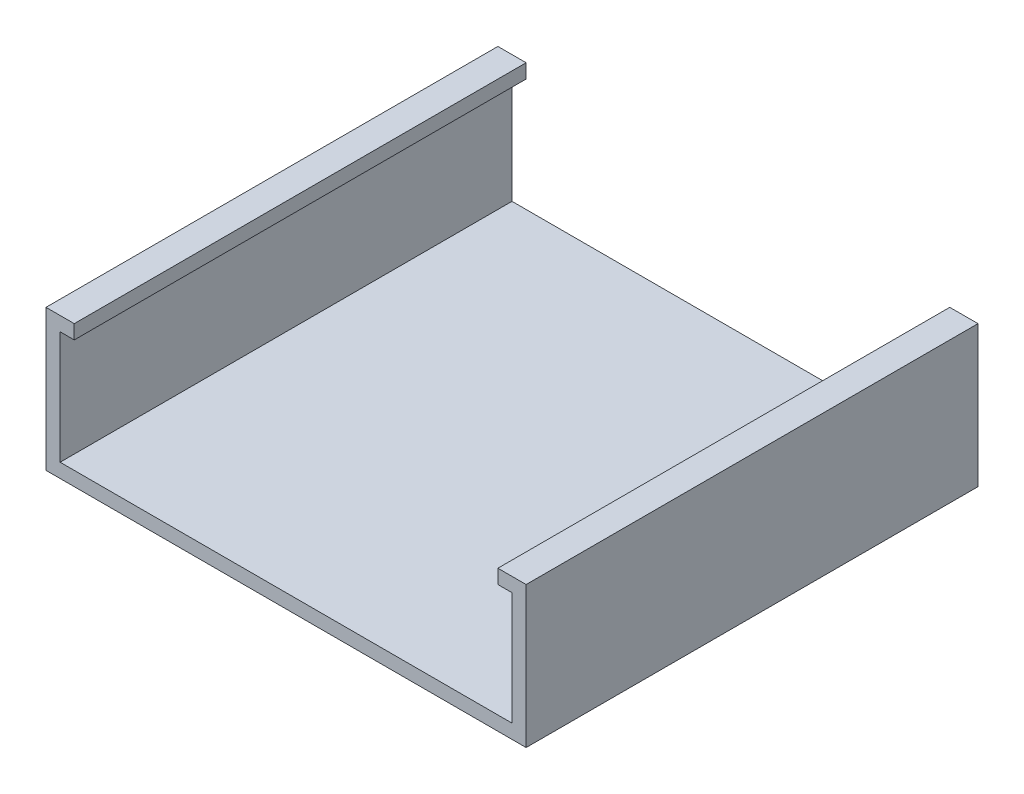
from build123d import *

# Parameters (mm, degrees)
SKETCH1_W           = 170
SKETCH1_H           = 160
BOSS_EXTRUDE2_DEPTH = 50
CUT_EXTRUDE2_REACH  = 189.949
SKETCH3_W           = 160
SKETCH3_H           = 40
CUT_EXTRUDE3_REACH  = 128.984
SKETCH4_W           = 150
SKETCH4_H           = 160


with BuildPart() as part:
    # Sketch1 → Boss-Extrude2 (new body)
    with BuildSketch(Plane(origin=(0, 0, 0), x_dir=(1, 0, 0), z_dir=(0, 1, 0))):
        Rectangle(SKETCH1_W, SKETCH1_H)
    extrude(amount=BOSS_EXTRUDE2_DEPTH)

    # Sketch3 → Cut-Extrude2 (cut, up to next)
    with BuildSketch(Plane.XY.offset(80), mode=Mode.PRIVATE) as cut_extrude2_sk1:
        with Locations((0, 25)):
            Rectangle(SKETCH3_W, SKETCH3_H)
    cut_extrude2_tool1 = extrude(cut_extrude2_sk1.sketch, amount=-CUT_EXTRUDE2_REACH, mode=Mode.PRIVATE) & part.part
    add(cut_extrude2_tool1.solids().sort_by_distance((0, 25, 80))[0], mode=Mode.SUBTRACT)

    # Sketch4 → Cut-Extrude3 (cut, up to next)
    with BuildSketch(Plane(origin=(0, 50, 0), x_dir=(1, 0, 0), z_dir=(0, 1, 0)), mode=Mode.PRIVATE) as cut_extrude3_sk1:
        Rectangle(SKETCH4_W, SKETCH4_H)
    cut_extrude3_tool1 = extrude(cut_extrude3_sk1.sketch, amount=-CUT_EXTRUDE3_REACH, mode=Mode.PRIVATE) & part.part
    add(cut_extrude3_tool1.solids().sort_by_distance((0, 50, 0))[0], mode=Mode.SUBTRACT)


solid = part.part
